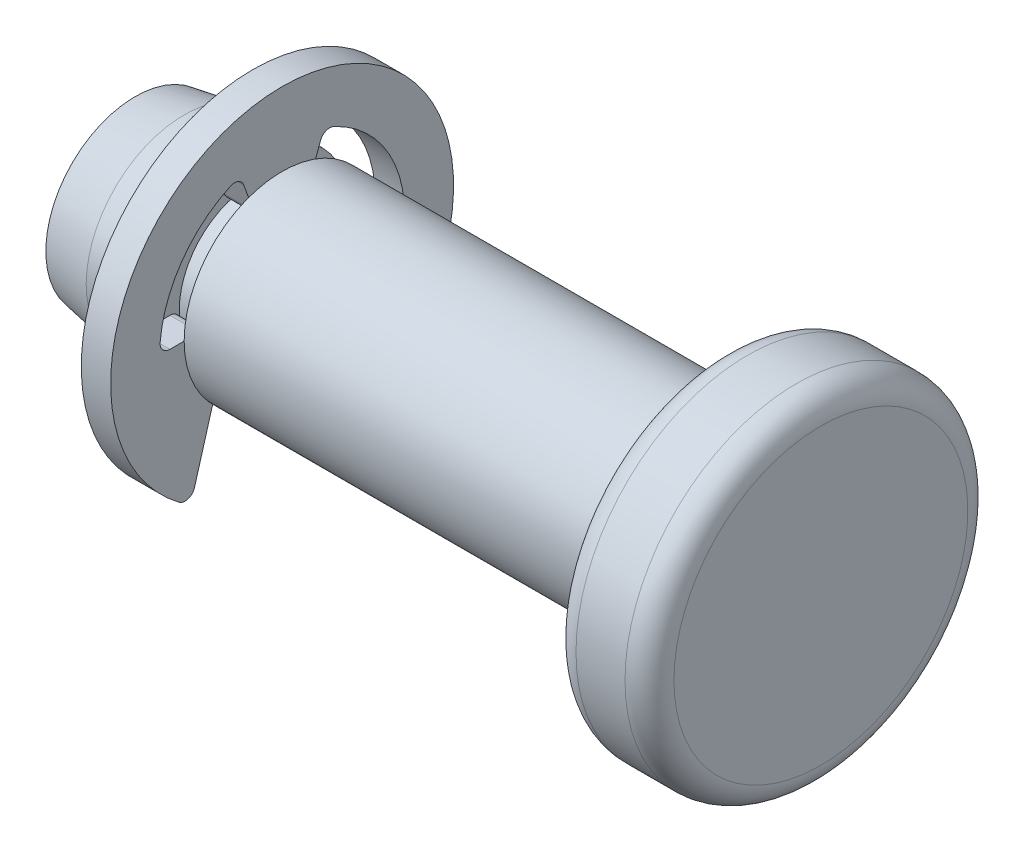
from build123d import *

# Parameters (mm, degrees)
CHAMFER_1_SIZE  = 1
CHAMFER_1_SIZE2 = 0.176326981
FILLET_1_R      = 0.5
EXTRUDE_2_DEPTH = 0.6
FILLET_2_R      = 0.2


with BuildPart() as part:
    # 草图1 → 旋转1 (revolve)
    with BuildSketch(Plane(origin=(0, 0, 0), x_dir=(1, 0, 0), z_dir=(0, 1, 0)), mode=Mode.PRIVATE) as revolve_1_sk:
        Polygon((-14, 0), (0, 0), (0, 3.5), (-2, 3.5), (-2, 2), (-11, 2), (-11, 1.5), (-11.6, 1.5), (-11.6, 2), (-14, 2), align=None)
    revolve(revolve_1_sk.sketch.rotate(Axis((-14, 0, 0), (1, 0, 0)), 180), axis=Axis((-14, 0, 0), (1, 0, 0)))

    # 倒角1
    chamfer_1_edges = [part.edges().sort_by_distance(p)[0] for p in [
        (-14, 0, -2),
    ]]
    chamfer_1_side = [part.faces().sort_by_distance(p)[0] for p in [
        (-12.8, 0, -2),
    ]]
    chamfer(chamfer_1_edges, length=CHAMFER_1_SIZE, length2=CHAMFER_1_SIZE2, reference=chamfer_1_side[0])

    # 圆角1
    fillet_1_edges = [part.edges().sort_by_distance(p)[0] for p in [
        (-2, 0, -3.5),
        (0, 0, -3.5),
    ]]
    fillet(fillet_1_edges, radius=FILLET_1_R)


with BuildPart() as body_2:
    # 草图3 → 凸台-拉伸2 (new body)
    with BuildSketch(Plane.ZY.offset(11)):
        with BuildLine():
            Line((-1.5, 0), (-2.5, 0))
            ThreePointArc((-2.5, 0), (-2.047880111, 1.433941091), (-0.855050358, 2.349231552))
            Line((-0.855050358, 2.349231552), (-0.513030215, 1.409538931))
            ThreePointArc((-0.513030215, 1.409538931), (0, 1.5), (0.513030215, 1.409538931))
            Line((0.513030215, 1.409538931), (0.855050358, 2.349231552))
            ThreePointArc((0.855050358, 2.349231552), (2.047880111, 1.433941091), (2.5, 0))
            Line((2.5, 0), (1.5, 0))
            ThreePointArc((1.5, 0), (1.436140662, -0.433012702), (1.25, -0.829156198))
            Line((1.25, -0.829156198), (1.865639407, -2.961315519))
            ThreePointArc((1.865639407, -2.961315519), (0, 3.5), (-1.865639407, -2.961315519))
            Line((-1.865639407, -2.961315519), (-1.25, -0.829156198))
            ThreePointArc((-1.25, -0.829156198), (-1.436140662, -0.433012702), (-1.5, 0))
        make_face()
    extrude(amount=EXTRUDE_2_DEPTH)

    # 圆角2
    fillet_2_edges = [body_2.edges().sort_by_distance(p)[0] for p in [
        (-11.3, -0.829156198, -1.25),
        (-11.3, -2.961315519, -1.865639407),
        (-11.3, -2.961315519, 1.865639407),
        (-11.3, -0.829156198, 1.25),
        (-11.3, 0, 1.5),
        (-11.3, 0, 2.5),
        (-11.3, 2.349231552, 0.855050358),
        (-11.3, 1.409538931, 0.513030215),
        (-11.3, 1.409538931, -0.513030215),
        (-11.3, 2.349231552, -0.855050358),
        (-11.3, 0, -2.5),
        (-11.3, 0, -1.5),
    ]]
    fillet(fillet_2_edges, radius=FILLET_2_R)


solid = Compound([part.part, body_2.part])
